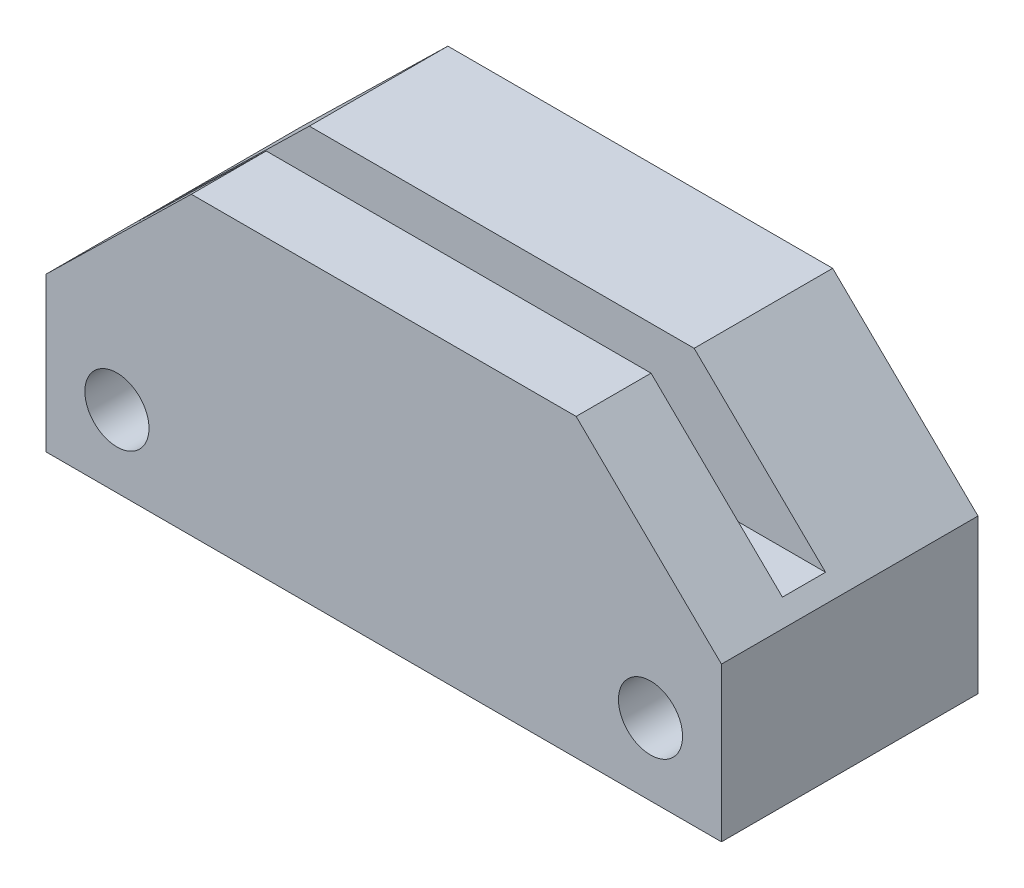
from build123d import *

# Parameters (mm, degrees)
EXTRUDE_1_DEPTH     = 10
SKETCH_2_W          = 26.33
SKETCH_2_H          = 1.68
CUT_EXTRUDE_1_DEPTH = 5
CUT_EXTRUDE_2_REACH = 32.434
SKETCH_3_R          = 1.25


with BuildPart() as part:
    # 草图1 → 凸台-拉伸1 (new body)
    with BuildSketch(Plane.XY):
        Polygon((0, 0), (26.33, 0), (26.33, 6), (20.665, 11.53), (5.665, 11.53), (0, 6), align=None)
    extrude(amount=EXTRUDE_1_DEPTH)

    # 草图2 → 切除-拉伸1 (cut)
    with BuildSketch(Plane(origin=(0, 11.53, 0), x_dir=(1, 0, 0), z_dir=(0, 1, 0))):
        with Locations((13.165, -6.24)):
            Rectangle(SKETCH_2_W, SKETCH_2_H)
    extrude(amount=-CUT_EXTRUDE_1_DEPTH, mode=Mode.SUBTRACT)

    # 草图3 → 切除-拉伸2 (cut, up to next)
    with BuildSketch(Plane(origin=(0, 0, 0), x_dir=(-1, 0, 0), z_dir=(0, 0, -1)), mode=Mode.PRIVATE) as cut_extrude_2_sk1:
        with Locations((-23.565, 2.8)):
            Circle(SKETCH_3_R)
    cut_extrude_2_tool1 = extrude(cut_extrude_2_sk1.sketch, amount=-CUT_EXTRUDE_2_REACH, mode=Mode.PRIVATE) & part.part
    # 草图3 → 切除-拉伸2 (cut, up to next)
    with BuildSketch(Plane(origin=(0, 0, 0), x_dir=(-1, 0, 0), z_dir=(0, 0, -1)), mode=Mode.PRIVATE) as cut_extrude_2_sk2:
        with Locations((-2.765, 2.8)):
            Circle(SKETCH_3_R)
    cut_extrude_2_tool2 = extrude(cut_extrude_2_sk2.sketch, amount=-CUT_EXTRUDE_2_REACH, mode=Mode.PRIVATE) & part.part
    add(cut_extrude_2_tool1.solids().sort_by_distance((23.565, 2.8, 0))[0], mode=Mode.SUBTRACT)
    add(cut_extrude_2_tool2.solids().sort_by_distance((2.765, 2.8, 0))[0], mode=Mode.SUBTRACT)


solid = part.part
